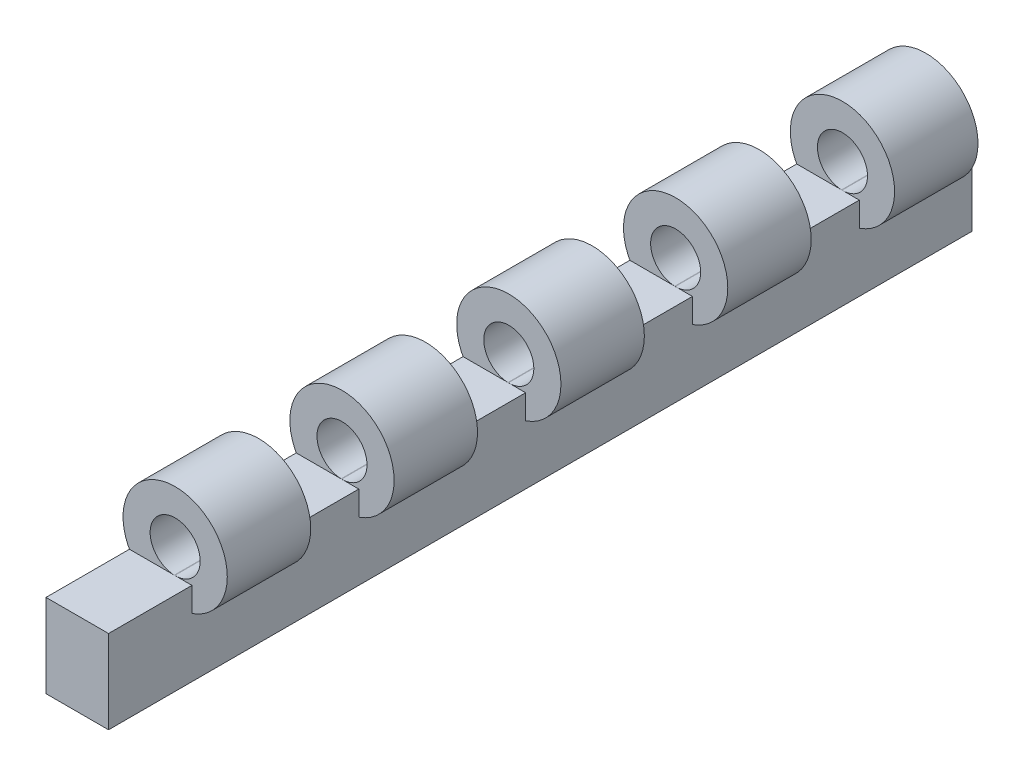
from build123d import *

# Parameters (mm, degrees)
SKETCH1_W           = 15
SKETCH1_H           = 207
BOSS_EXTRUDE1_DEPTH = 20
SKETCH2_R           = 12.5
SKETCH2_R_2         = 6
BOSS_EXTRUDE3_DEPTH = 20
LPATTERN2_COUNT     = 5
LPATTERN2_PITCH     = 40


with BuildPart() as part:
    # Sketch1 → Boss-Extrude1 (new body)
    with BuildSketch(Plane(origin=(0, 0, 0), x_dir=(1, 0, 0), z_dir=(0, 1, 0))):
        with Locations((7.5, 0)):
            Rectangle(SKETCH1_W, SKETCH1_H)
    extrude(amount=BOSS_EXTRUDE1_DEPTH)


with BuildPart() as body_2:
    # Sketch2 → Boss-Extrude3 (new body)
    with BuildSketch(Plane.XY.offset(83.5)):
        with Locations((10.969005493, 25.994240443)):
            Circle(SKETCH2_R)
        with Locations((10.969005493, 25.994240443)):
            Circle(SKETCH2_R_2, mode=Mode.SUBTRACT)
    boss_extrude3 = extrude(amount=-BOSS_EXTRUDE3_DEPTH)


with BuildPart() as lpattern2_1:
    # LPattern2: Boss-Extrude3 ×5
    with Locations(*[(0, 0, -i * LPATTERN2_PITCH) for i in range(1, LPATTERN2_COUNT)]):
        add(boss_extrude3)


solid = Compound([part.part, body_2.part, lpattern2_1.part])
